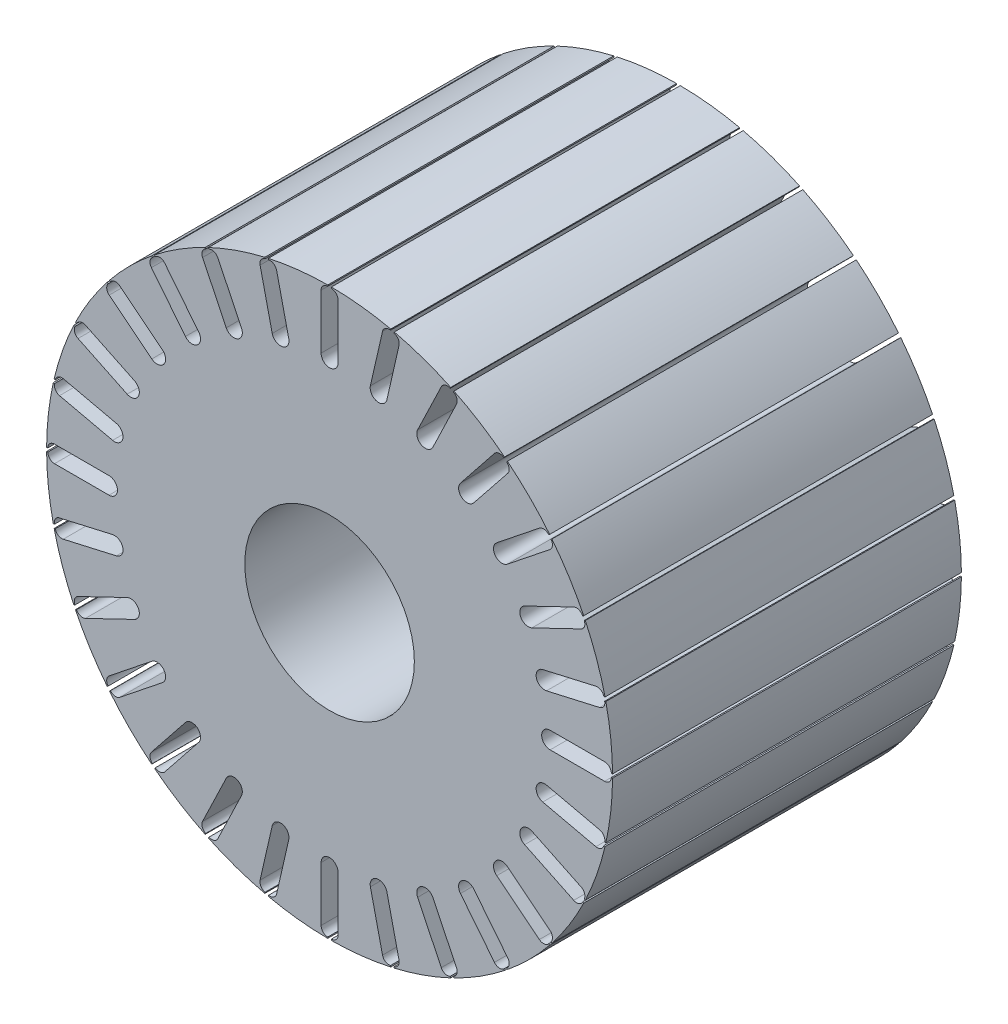
from build123d import *

# Parameters (mm, degrees)
SKETCH1_R           = 116.8
SKETCH1_R_2         = 35
BOSS_EXTRUDE1_DEPTH = 72
CUT_EXTRUDE1_REACH  = 221.136
CIRPATTERN1_COUNT   = 28


with BuildPart() as part:
    # Sketch1 → Boss-Extrude1 (new, symmetric)
    with BuildSketch(Plane.XY):
        Circle(SKETCH1_R)
        Circle(SKETCH1_R_2, mode=Mode.SUBTRACT)
    extrude(amount=BOSS_EXTRUDE1_DEPTH, both=True)

    # Sketch2 → Cut-Extrude1 (cut, up to next)
    with BuildSketch(Plane.XY.offset(72), mode=Mode.PRIVATE) as cut_extrude1_sk1:
        with BuildLine():
            Line((116.8, -0.75), (116.8, 0.75))
            Line((116.8, 0.75), (116.29758166, 0.75))
            ThreePointArc((116.29758166, 0.75), (115.492125308, 2.694543648), (113.54758166, 3.5))
            Line((113.54758166, 3.5), (91.04758166, 3.5))
            ThreePointArc((91.04758166, 3.5), (88.572707926, 2.474873734), (87.54758166, 0))
            ThreePointArc((87.54758166, 0), (88.572707926, -2.474873734), (91.04758166, -3.5))
            Line((91.04758166, -3.5), (113.54758166, -3.5))
            ThreePointArc((113.54758166, -3.5), (115.492125308, -2.694543648), (116.29758166, -0.75))
            Line((116.29758166, -0.75), (116.8, -0.75))
        make_face()
    cut_extrude1_tool1 = extrude(cut_extrude1_sk1.sketch, amount=-CUT_EXTRUDE1_REACH, mode=Mode.PRIVATE) & part.part
    cut_extrude1 = cut_extrude1_tool1.solids().sort_by_distance((102.11807, 0, 72))[0]
    add(cut_extrude1, mode=Mode.SUBTRACT)

    # CirPattern1: Cut-Extrude1 ×28 about axis
    cirpattern1_axis = Axis((0, 0, 0), (0, 0, 1))
    for i in range(1, CIRPATTERN1_COUNT):
        add(cut_extrude1.rotate(cirpattern1_axis, i * 360 / CIRPATTERN1_COUNT), mode=Mode.SUBTRACT)


solid = part.part
